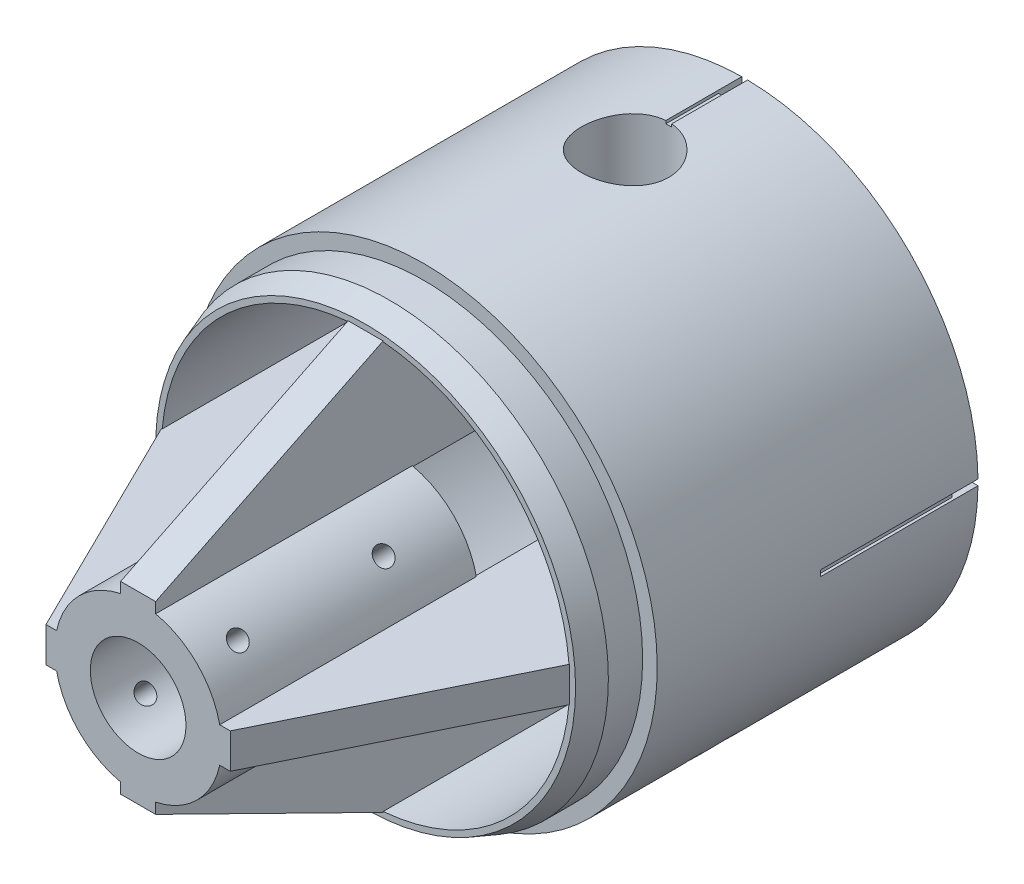
from build123d import *

# Parameters (mm, degrees)
SCHIZZO1_R                    = 40
SCHIZZO1_R_2                  = 30
ESTRUSIONE_ESTRUSIONE1_DEPTH  = 12.3
SCHIZZO2_R                    = 40
SCHIZZO2_R_2                  = 35
ESTRUSIONE_ESTRUSIONE2_DEPTH  = 42.7
SCHIZZO3_R                    = 37.5
SCHIZZO3_R_2                  = 35
ESTRUSIONE_ESTRUSIONE3_DEPTH  = 10
SCHIZZO5_R                    = 14.3
SCHIZZO5_R_2                  = 8.2
ESTRUSIONE_ESTRUSIONE4_DEPTH  = 44
ESTRUSIONE_ESTRUSIONE5_DEPTH  = 3
RIPETIZIONECIRCOLARE1_COUNT   = 4
SCHIZZO9_W                    = 20
SCHIZZO9_H                    = 20
ESTRUSIONE_ESTRUSIONE6_DEPTH  = 15
SCHIZZO7_R                    = 7.5
TAGLIO_ESTRUSIONE1_DEPTH      = 124.735362771
SCHIZZO11_R                   = 2
TAGLIO_ESTRUSIONE2_DEPTH      = 136.314864573
ESTRUSIONE_ESTRUSIONE7_START  = -4
SCHIZZO12_R                   = 8.2
SCHIZZO12_R_2                 = 4.5
ESTRUSIONE_ESTRUSIONE7_DEPTH  = 4
TAGLIO_ESTRUSIONE3_DEPTH      = 38
SCHIZZO14_W                   = 1
SCHIZZO14_H                   = 4
TAGLIO_ESTRUSIONE4_DEPTH      = 119.389188763
RIPETIZIONECIRCOLARE2_COUNT   = 4
SCHIZZO17_W                   = 27
SCHIZZO17_H                   = 1
TAGLIO_ESTRUSIONE5_DEPTH      = 0.5
RIPETIZIONECIRCOLARE3_COUNT   = 4
SCHIZZO18_W                   = 1
SCHIZZO18_H                   = 55
TAGLIO_ESTRUSIONE6_DEPTH      = 0.5
SCHIZZO19_R                   = 1.25
TAGLIO_ESTRUSIONE7_DEPTH      = 15
TAGLIO_ESTRUSIONE8_DEPTH      = 119.389188763
TAGLIO_ESTRUSIONE8_DEPTH_BACK = 119.389188763
SCHIZZO20_R                   = 1.6
SMUSSO1_SIZE                  = 1.5
SMUSSO1_SIZE2                 = 4.121216129


with BuildPart() as part:
    # Schizzo1 → Estrusione-Estrusione1 (new body)
    with BuildSketch(Plane.XY):
        Circle(SCHIZZO1_R)
        Circle(SCHIZZO1_R_2, mode=Mode.SUBTRACT)
    extrude(amount=ESTRUSIONE_ESTRUSIONE1_DEPTH)

    # Schizzo2 → Estrusione-Estrusione2 (add)
    with BuildSketch(Plane.XY.offset(12.3)):
        Circle(SCHIZZO2_R)
        Circle(SCHIZZO2_R_2, mode=Mode.SUBTRACT)
    extrude(amount=ESTRUSIONE_ESTRUSIONE2_DEPTH)

    # Schizzo3 → Estrusione-Estrusione3 (add)
    with BuildSketch(Plane.XY.offset(55)):
        Circle(SCHIZZO3_R)
        Circle(SCHIZZO3_R_2, mode=Mode.SUBTRACT)
    extrude(amount=ESTRUSIONE_ESTRUSIONE3_DEPTH)



with BuildPart() as body_2:
    # Schizzo5 → Estrusione-Estrusione4 (new body)
    with BuildSketch(Plane.XY.offset(104)):
        Circle(SCHIZZO5_R)
        Circle(SCHIZZO5_R_2, mode=Mode.SUBTRACT)
    extrude(amount=-ESTRUSIONE_ESTRUSIONE4_DEPTH)


with BuildPart() as part_1:
    add(part.part)

    add(body_2.part)  # Estrusione-Estrusione5 merges body 2
    # Schizzo6 → Estrusione-Estrusione5 (add, symmetric)
    with BuildSketch(Plane(origin=(0, 0, 0), x_dir=(1, 0, 0), z_dir=(0, 1, 0))):
        Polygon((-35, -26), (-35, -65), (-15.8, -104), (-13.8, -104), (-13.8, -26), align=None)
    estrusione_estrusione5 = extrude(amount=ESTRUSIONE_ESTRUSIONE5_DEPTH, both=True)

    # RipetizioneCircolare1: Estrusione-Estrusione5 ×4 about axis
    ripetizionecircolare1_axis = Axis((0, 0, -5.2), (0, 0, 1))
    for i in range(1, RIPETIZIONECIRCOLARE1_COUNT):
        add(estrusione_estrusione5.rotate(ripetizionecircolare1_axis, i * 360 / RIPETIZIONECIRCOLARE1_COUNT))

    # Schizzo9 → Estrusione-Estrusione6 (add)
    with BuildSketch(Plane(origin=(0, 21.8, 0), x_dir=(-1, 0, 0), z_dir=(0, -1, 0))):
        with Locations((0, -21)):
            Rectangle(SCHIZZO9_W, SCHIZZO9_H)
    extrude(amount=-ESTRUSIONE_ESTRUSIONE6_DEPTH)

    # Schizzo7 → Taglio-Estrusione1 (cut, through all)
    with BuildSketch(Plane.XZ.offset(-13.8)):
        with Locations((0, 20.5)):
            Circle(SCHIZZO7_R)
    extrude(amount=-TAGLIO_ESTRUSIONE1_DEPTH, mode=Mode.SUBTRACT)

    # Schizzo11 → Taglio-Estrusione2 (cut, through all)
    with BuildSketch(Plane(origin=(21.213203436, -21.213203436, 0), x_dir=(0, 0, 1), z_dir=(0.7071067811865488, -0.7071067811865464, 0))):
        with Locations((32, 0)):
            Circle(SCHIZZO11_R)
        with Locations((38, 0)):
            Circle(SCHIZZO11_R)
    extrude(amount=TAGLIO_ESTRUSIONE2_DEPTH, mode=Mode.SUBTRACT)

    # Schizzo12 → Estrusione-Estrusione7 (add)
    with BuildSketch(Plane(origin=(0, 0, 60), x_dir=(-1, 0, 0), z_dir=(0, 0, -1)).offset(ESTRUSIONE_ESTRUSIONE7_START)):
        Circle(SCHIZZO12_R)
        Circle(SCHIZZO12_R_2, mode=Mode.SUBTRACT)
    extrude(amount=ESTRUSIONE_ESTRUSIONE7_DEPTH)

    # Schizzo13 → Taglio-Estrusione3 (cut)
    with BuildSketch(Plane(origin=(0, 0, 0), x_dir=(1, 0, 0), z_dir=(0, 1, 0))):
        with BuildLine():
            Line((-2.6, 0), (-2.6, -5.1))
            ThreePointArc((-2.6, -5.1), (0, -7.7), (2.6, -5.1))
            Line((2.6, -5.1), (2.6, 0))
            Line((2.6, 0), (-2.6, 0))
        make_face()
    taglio_estrusione3 = extrude(amount=-TAGLIO_ESTRUSIONE3_DEPTH, mode=Mode.SUBTRACT)

    # Schizzo14 → Taglio-Estrusione4 (cut, through all)
    with BuildSketch(Plane(origin=(0, 0, 0), x_dir=(1, 0, 0), z_dir=(0, 1, 0))):
        with Locations((0, -2)):
            Rectangle(SCHIZZO14_W, SCHIZZO14_H)
    taglio_estrusione4 = extrude(amount=-TAGLIO_ESTRUSIONE4_DEPTH, mode=Mode.SUBTRACT)

    # RipetizioneCircolare2: Taglio-Estrusione3, Taglio-Estrusione4 ×4 about axis
    ripetizionecircolare2_axis = Axis((0, 0, -5.2), (0, 0, 1))
    add([taglio_estrusione3.rotate(ripetizionecircolare2_axis, i * 360 / RIPETIZIONECIRCOLARE2_COUNT) for i in range(1, RIPETIZIONECIRCOLARE2_COUNT)], mode=Mode.SUBTRACT)
    add([taglio_estrusione4.rotate(ripetizionecircolare2_axis, i * 360 / RIPETIZIONECIRCOLARE2_COUNT) for i in range(1, RIPETIZIONECIRCOLARE2_COUNT)], mode=Mode.SUBTRACT)

    # Schizzo17 → Taglio-Estrusione5 (cut)
    with BuildSketch(Plane(origin=(0, -40, 0), x_dir=(0, 0, -1), z_dir=(0, 1, 0))):
        with Locations((-13.5, 0)):
            Rectangle(SCHIZZO17_W, SCHIZZO17_H)
    taglio_estrusione5 = extrude(amount=TAGLIO_ESTRUSIONE5_DEPTH, mode=Mode.SUBTRACT)

    # RipetizioneCircolare3: Taglio-Estrusione5 ×4 about axis
    ripetizionecircolare3_axis = Axis((0, 0, -5.2), (0, 0, 1))
    for i in range(1, RIPETIZIONECIRCOLARE3_COUNT):
        add(taglio_estrusione5.rotate(ripetizionecircolare3_axis, i * 360 / RIPETIZIONECIRCOLARE3_COUNT), mode=Mode.SUBTRACT)

    # Schizzo18 → Taglio-Estrusione6 (cut)
    with BuildSketch(Plane(origin=(0, -40, 0), x_dir=(1, 0, 0), z_dir=(0, 1, 0))):
        with Locations((0, -27.5)):
            Rectangle(SCHIZZO18_W, SCHIZZO18_H)
    extrude(amount=TAGLIO_ESTRUSIONE6_DEPTH, mode=Mode.SUBTRACT)

    # Schizzo19 → Taglio-Estrusione7 (cut)
    with BuildSketch(Plane(origin=(0, 0, 26), x_dir=(-1, 0, 0), z_dir=(0, 0, -1))):
        with Locations((-21, 0)):
            Circle(SCHIZZO19_R)
        with Locations((21, 0)):
            Circle(SCHIZZO19_R)
    extrude(amount=-TAGLIO_ESTRUSIONE7_DEPTH, mode=Mode.SUBTRACT)

    # Schizzo20 → Taglio-Estrusione8 (cut, two sides: drawn at the far end of the back side and taken through both)
    with BuildSketch(Plane(origin=(0, 0, 0), x_dir=(0, 0, 1), z_dir=(0.7071067811865488, 0.7071067811865464, 0)).offset(-TAGLIO_ESTRUSIONE8_DEPTH_BACK)):
        with Locations((97, 0)):
            Circle(SCHIZZO20_R)
        with Locations((72, 0)):
            Circle(SCHIZZO20_R)
    extrude(amount=TAGLIO_ESTRUSIONE8_DEPTH + TAGLIO_ESTRUSIONE8_DEPTH_BACK, mode=Mode.SUBTRACT)

    # Smusso1
    smusso1_edges = [part_1.edges().sort_by_distance(p)[0] for p in [
        (-37.5, 0, 65),
    ]]
    smusso1_side = [part_1.faces().sort_by_distance(p)[0] for p in [
        (-36.439339828, 0, 65),
    ]]
    chamfer(smusso1_edges, length=SMUSSO1_SIZE, length2=SMUSSO1_SIZE2, reference=smusso1_side[0])


solid = part_1.part
